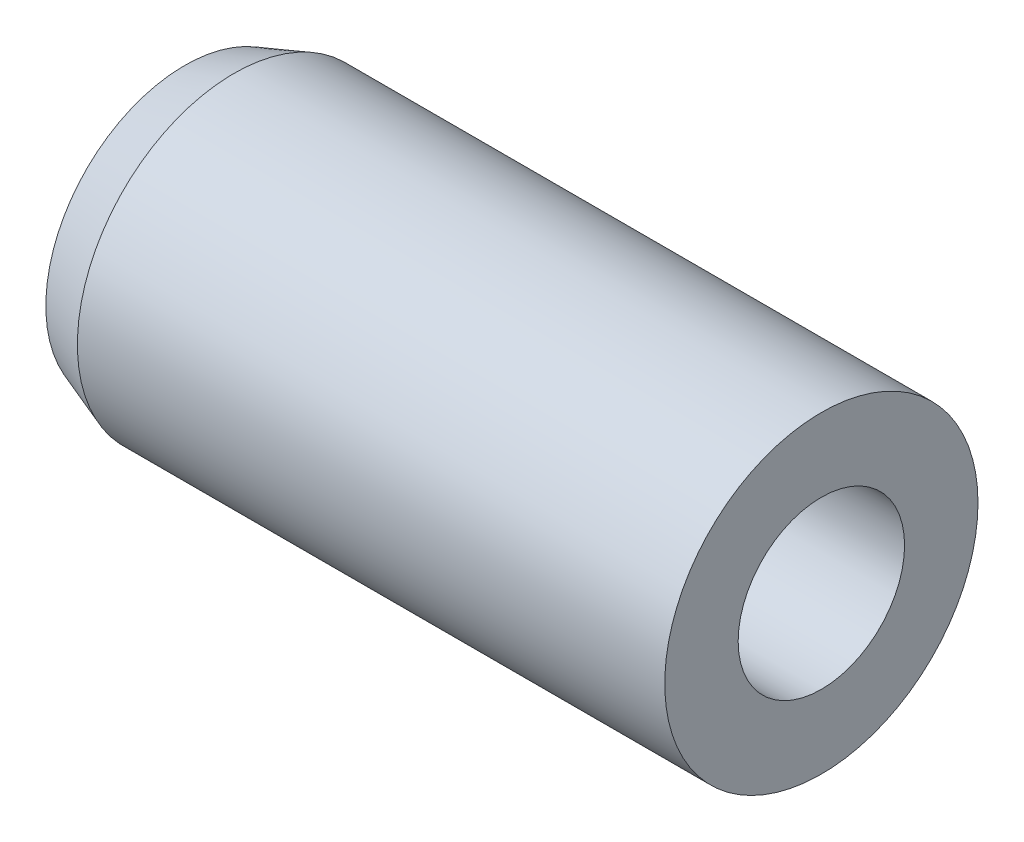
from build123d import *

# Parameters (mm, degrees)
TALADRO_ROSCADO_M101_D     = 8.5
TALADRO_ROSCADO_M101_DEPTH = 15
TALADRO_ROSCADO_M101_TIP   = 2.553657631
CORTAR_EXTRUIR1_DEPTH      = 5


with BuildPart() as part:
    # Sketch1 → Revolve1 (revolve)
    with BuildSketch(Plane.XY, mode=Mode.PRIVATE) as revolve1_sk:
        Polygon((0, 0), (-32.518320182, 0), (-32.518320182, 7.092937258), (-30, 8), (0, 8), align=None)
    revolve(revolve1_sk.sketch.rotate(Axis((0, 0, 0), (-1, 0, 0)), 90), axis=Axis((0, 0, 0), (-1, 0, 0)))

    # Taladro roscado M101
    with Locations(Plane(origin=(0, 0, 0), x_dir=(0, 0, -1), z_dir=(1, 0, 0))):
        with Locations((0, 0)):
            Hole(TALADRO_ROSCADO_M101_D / 2, depth=TALADRO_ROSCADO_M101_DEPTH)
            with Locations((0, 0, -(TALADRO_ROSCADO_M101_DEPTH + TALADRO_ROSCADO_M101_TIP / 2))):  # 118° drill point
                Cone(0, TALADRO_ROSCADO_M101_D / 2, TALADRO_ROSCADO_M101_TIP, mode=Mode.SUBTRACT)

    # Croquis3 → Cortar-Extruir1 (cut)
    with BuildSketch(Plane.ZY.offset(32.518320182)):
        Polygon((0, -3.156760752), (2.733835005, -1.578380376), (2.733835005, 1.578380376), (0, 3.156760752), (-2.733835005, 1.578380376), (-2.733835005, -1.578380376), align=None)
    extrude(amount=-CORTAR_EXTRUIR1_DEPTH, mode=Mode.SUBTRACT)


solid = part.part
